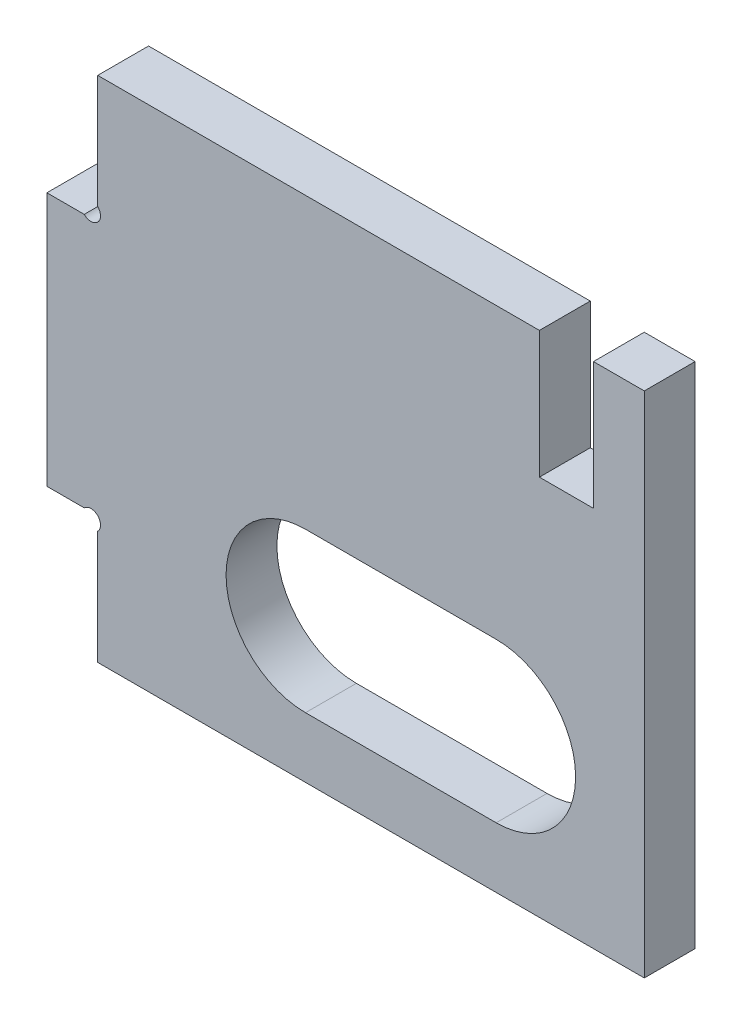
from build123d import *

# Parameters (mm, degrees)
BOSS_EXTRU_1_DEPTH = 8


with BuildPart() as part:
    # Esquisse1 → Boss.-Extru.1 (new body)
    with BuildSketch(Plane.XY):
        with BuildLine():
            Line((-48.206262386, 70.57122428), (-48.206262386, 52.692544623))
            ThreePointArc((-48.206262386, 52.692544623), (-48.206262386, 50.57122428), (-50.327582729, 50.57122428))
            Line((-50.327582729, 50.57122428), (-56.206262386, 50.57122428))
            Line((-56.206262386, 50.57122428), (-56.206262386, 10.57122428))
            Line((-56.206262386, 10.57122428), (-50.327582729, 10.57122428))
            ThreePointArc((-50.327582729, 10.57122428), (-48.206262386, 10.57122428), (-48.206262386, 8.449903936))
            Line((-48.206262386, 8.449903936), (-48.206262386, -9.42877572))
            Line((-48.206262386, -9.42877572), (37.793737614, -9.42877572))
            Line((37.793737614, -9.42877572), (37.793737614, 70.57122428))
            Line((37.793737614, 70.57122428), (29.793737614, 70.57122428))
            Line((29.793737614, 70.57122428), (29.793737614, 50.57122428))
            Line((29.793737614, 50.57122428), (21.293737614, 50.57122428))
            Line((21.293737614, 50.57122428), (21.293737614, 70.57122428))
            Line((21.293737614, 70.57122428), (-48.206262386, 70.57122428))
        make_face()
        with BuildLine():
            Line((-15.511163156, 25.07122428), (14.488836844, 25.07122428))
            ThreePointArc((14.488836844, 25.07122428), (26.988836844, 12.57122428), (14.488836844, 0.07122428))
            Line((14.488836844, 0.07122428), (-15.511163156, 0.07122428))
            ThreePointArc((-15.511163156, 0.07122428), (-28.011163156, 12.57122428), (-15.511163156, 25.07122428))
        make_face(mode=Mode.SUBTRACT)
    extrude(amount=BOSS_EXTRU_1_DEPTH)


solid = part.part
